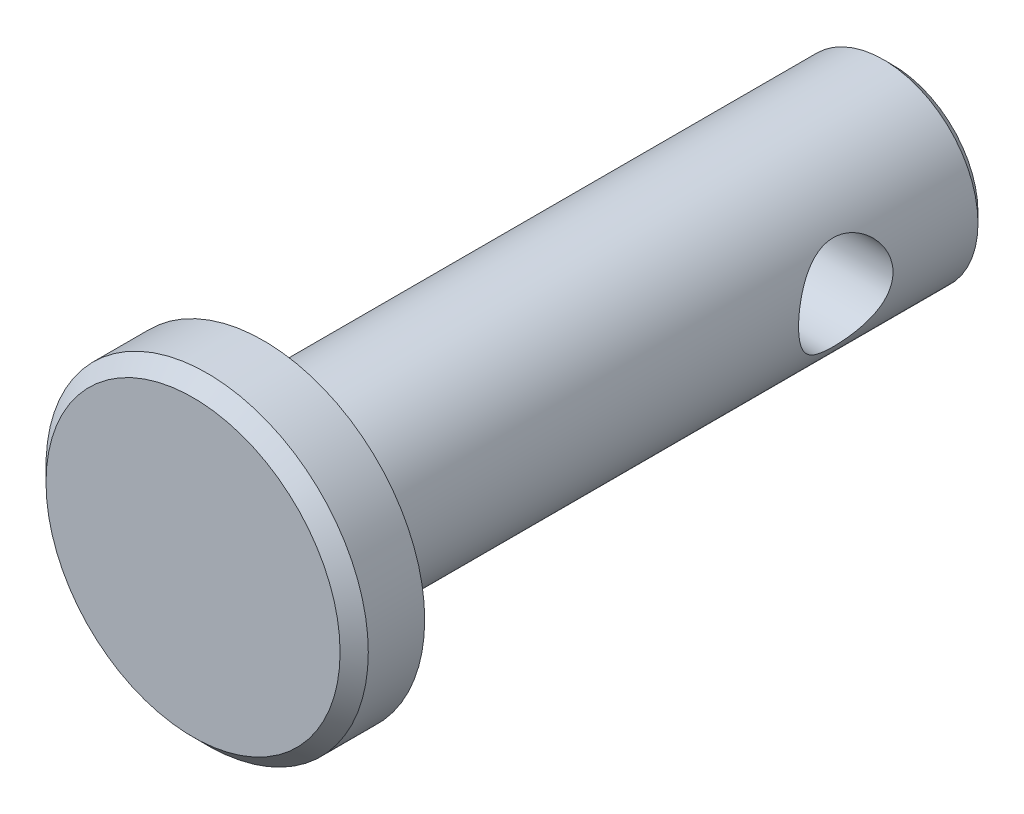
from build123d import *

# Parameters (mm, degrees)
SKETCH1_R           = 2.38125
EXTRUDE1_DEPTH      = 7.9375
SKETCH2_R           = 4.064
EXTRUDE2_DEPTH      = 1.778
CHAMFER1_SIZE       = 0.3556
EXTRUDE3_DEPTH      = 12.288185516
EXTRUDE3_DEPTH_BACK = 12.288185516
SKETCH3_R           = 1.190625
CHAMFER2_SIZE       = 0.238125


with BuildPart() as part:
    # Sketch1 → Extrude1 (new, symmetric)
    with BuildSketch(Plane.XY):
        Circle(SKETCH1_R)
    extrude(amount=EXTRUDE1_DEPTH, both=True)

    # Sketch2 → Extrude2 (add)
    with BuildSketch(Plane.XY.offset(7.9375)):
        Circle(SKETCH2_R)
    extrude(amount=EXTRUDE2_DEPTH)

    # Chamfer1
    chamfer1_edges = [part.edges().sort_by_distance(p)[0] for p in [
        (-4.064, 0, 9.7155),
    ]]
    chamfer(chamfer1_edges, length=CHAMFER1_SIZE)

    # Sketch3 → Extrude3 (cut, two sides: drawn at the far end of the back side and taken through both)
    with BuildSketch(Plane(origin=(0, 0, 0), x_dir=(0, 0, -1), z_dir=(1, 0, 0)).offset(-EXTRUDE3_DEPTH_BACK)):
        with Locations(Location((4.365625, 0, 0), (0, 0, 179.999999999))):
            Circle(SKETCH3_R)
    extrude(amount=EXTRUDE3_DEPTH + EXTRUDE3_DEPTH_BACK, mode=Mode.SUBTRACT)

    # Chamfer2
    chamfer2_edges = [part.edges().sort_by_distance(p)[0] for p in [
        (-2.38125, 0, -7.9375),
    ]]
    chamfer(chamfer2_edges, length=CHAMFER2_SIZE)


solid = part.part
